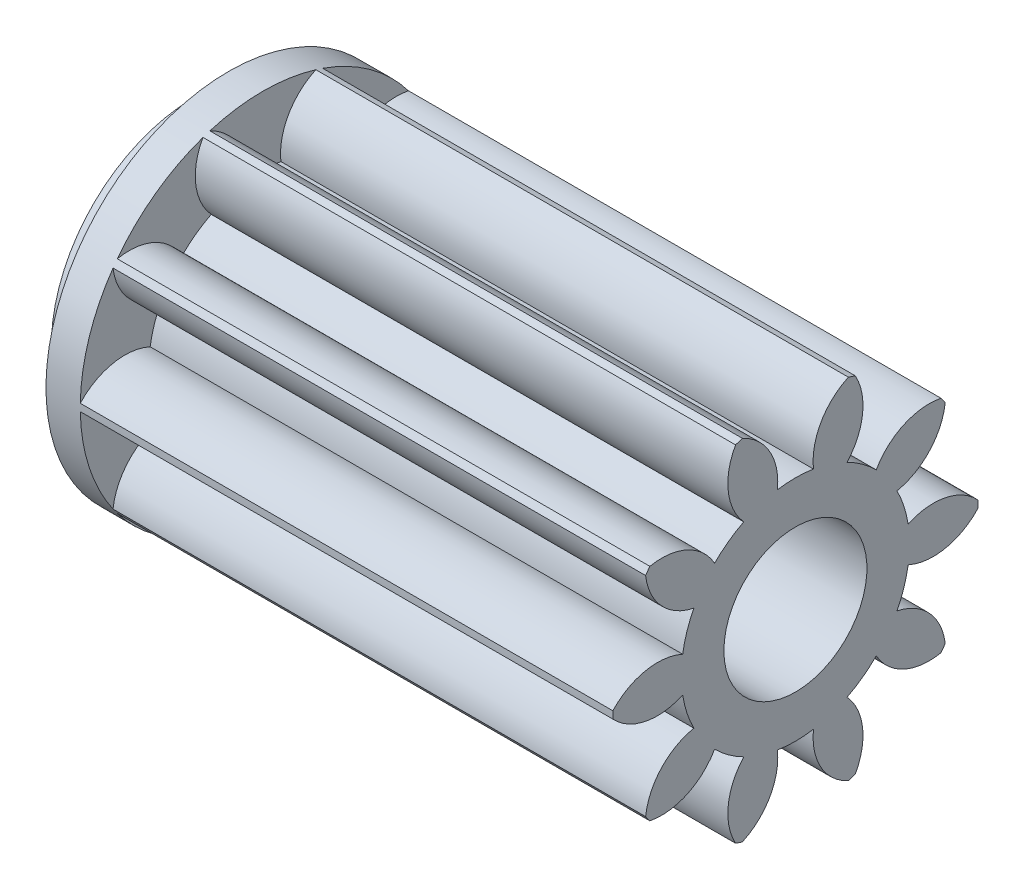
from build123d import *

# Parameters (mm, degrees)
BASPROSKE_W     = 17.5
BASPROSKE_H     = 6
TOOTHCUT_DEPTH  = 20.448650339
TEETHCUTS_COUNT = 10
TEETHCUTS_ANGLE = 324
BORSKE_R        = 2.35
BORE_DEPTH      = 50.0000508
SCALE_1_SCALE   = 1.065


with BuildPart() as part:
    # BasProSke → Base-Revolve (revolve)
    with BuildSketch(Plane(origin=(0, 0, 0), x_dir=(1, 0, 0), z_dir=(0, 1, 0)), mode=Mode.PRIVATE) as base_revolve_sk:
        with Locations((8.75, 3)):
            Rectangle(BASPROSKE_W, BASPROSKE_H)
    revolve(base_revolve_sk.sketch.rotate(Axis((-10, 0, 0), (1, 0, 0)), 180), axis=Axis((-10, 0, 0), (1, 0, 0)))

    # TooCutSke → ToothCut (cut, through all)
    with BuildSketch(Plane(origin=(0, 0, 0), x_dir=(0, 0, -1), z_dir=(1, 0, 0))):
        with BuildLine():
            ThreePointArc((0.59278292, 3.701838653), (0, 3.749), (-0.59278292, 3.701838653))
            ThreePointArc((-0.59278292, 3.701838653), (-0.846593509, 4.924114224), (-1.775771316, 5.757784417))
            ThreePointArc((-1.775771316, 5.757784417), (0, 6.0254), (1.775771316, 5.757784417))
            ThreePointArc((1.775771316, 5.757784417), (0.846593509, 4.924114224), (0.59278292, 3.701838653))
        make_face()
    toothcut = extrude(amount=TOOTHCUT_DEPTH, mode=Mode.SUBTRACT)

    # TeethCuts: ToothCut ×10 about axis
    teethcuts_axis = Axis((-10, 0, 0), (1, 0, 0))
    for i in range(1, TEETHCUTS_COUNT):
        add(toothcut.rotate(teethcuts_axis, i * TEETHCUTS_ANGLE / (TEETHCUTS_COUNT - 1)), mode=Mode.SUBTRACT)

    # BorSke → Bore (cut, symmetric)
    with BuildSketch(Plane(origin=(0, 0, 0), x_dir=(0, 0, -1), z_dir=(1, 0, 0))):
        with Locations(Location((0, 0, 0), (0, 0, 180))):
            Circle(BORSKE_R)
    extrude(amount=BORE_DEPTH, both=True, mode=Mode.SUBTRACT)


with BuildPart() as part_1:
    # Масштаб1: scaled about (8.75, 0, 0)
    add(part.part.scale(SCALE_1_SCALE).moved(Location((-0.56875, 0, 0))))

    # Эскиз2 → Повернуть1 (revolve)
    with BuildSketch(Plane(origin=(0, 0, 0), x_dir=(1, 0, 0), z_dir=(0, 1, 0))):
        Polygon((-0.56875, 3.5), (-0.56875, 6.39), (-1.76875, 6.39), (-1.76875, 5), (-2.96875, 5), (-2.96875, 3.924264069), (-2.544485931, 3.5), align=None)
    revolve(axis=Axis((0, 0, 0), (-1, 0, 0)))


solid = part_1.part
